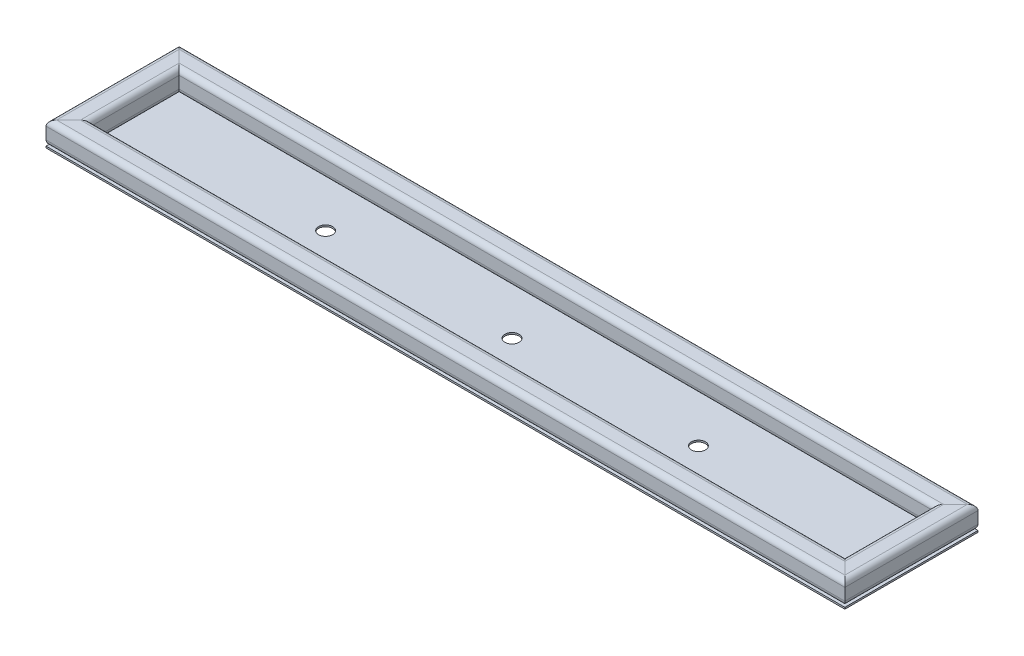
from build123d import *

# Parameters (mm, degrees)
TUBO_CUADRADO_2_X_2_X_0_25_1_DEPTH      = 186.921024484
TUBO_CUADRADO_2_X_2_X_0_25_1_DEPTH_BACK = 36.921024484
TUBO_CUADRADO_2_X_2_X_0_25_1_2_DEPTH    = 973.842048969
TUBO_CUADRADO_2_X_2_X_0_25_1_3_DEPTH    = 223.842048969
TUBO_CUADRADO_2_X_2_X_0_25_1_4_DEPTH    = 973.842048969
CROQUIS3_W                              = 900
CROQUIS3_H                              = 150
SALIENTE_EXTRUIR1_DEPTH                 = 1.9
CROQUIS4_R                              = 7.937500001
CORTAR_EXTRUIR1_DEPTH                   = 10


with BuildPart() as part:
    # Sketch1 → Tubo cuadrado 2 X 2 X 0.25(1) (new, two sides: drawn at the far end of the back side and taken through both)
    with BuildSketch(Plane(origin=(-437.3, 12.7, -75), x_dir=(1, 0, 0), z_dir=(0, 0, 1)).offset(-TUBO_CUADRADO_2_X_2_X_0_25_1_DEPTH_BACK)):
        with BuildLine():
            Line((-6.7, -12.7), (6.7, -12.7))
            ThreePointArc((6.7, -12.7), (10.942640687, -10.942640687), (12.7, -6.7))
            Line((12.7, -6.7), (12.7, 6.7))
            ThreePointArc((12.7, 6.7), (10.942640687, 10.942640687), (6.7, 12.7))
            Line((6.7, 12.7), (-6.7, 12.7))
            ThreePointArc((-6.7, 12.7), (-10.942640687, 10.942640687), (-12.7, 6.7))
            Line((-12.7, 6.7), (-12.7, -6.7))
            ThreePointArc((-12.7, -6.7), (-10.942640687, -10.942640687), (-6.7, -12.7))
        make_face()
        with BuildLine():
            Line((-6.7, -9.7), (6.7, -9.7))
            ThreePointArc((6.7, -9.7), (8.821320344, -8.821320344), (9.7, -6.7))
            Line((9.7, -6.7), (9.7, 6.7))
            ThreePointArc((9.7, 6.7), (8.821320344, 8.821320344), (6.7, 9.7))
            Line((6.7, 9.7), (-6.7, 9.7))
            ThreePointArc((-6.7, 9.7), (-8.821320344, 8.821320344), (-9.7, 6.7))
            Line((-9.7, 6.7), (-9.7, -6.7))
            ThreePointArc((-9.7, -6.7), (-8.821320344, -8.821320344), (-6.7, -9.7))
        make_face(mode=Mode.SUBTRACT)
    extrude(amount=TUBO_CUADRADO_2_X_2_X_0_25_1_DEPTH + TUBO_CUADRADO_2_X_2_X_0_25_1_DEPTH_BACK)

    # Tubo cuadrado 2 X 2 X 0.25(1) mitre 1
    split(bisect_by=Plane(origin=(-450, 0, -75), x_dir=(0, -1, 0), z_dir=(-0.707106781, 0, 0.707106781)), keep=Keep.TOP)

    # Tubo cuadrado 2 X 2 X 0.25(1) mitre 2
    split(bisect_by=Plane(origin=(-450, 0, 75), x_dir=(0, -1, 0), z_dir=(-0.707106781, 0, -0.707106781)), keep=Keep.TOP)


with BuildPart() as body_2:
    # Sketch1 on segment 2 (carried to segment 2) → Tubo cuadrado 2 X 2 X 0.25_1 2 (new body)
    with BuildSketch(Plane(origin=(-486.921024484, 12.7, 62.3), x_dir=(0, 0, -1), z_dir=(1, 0, 0))):
        with BuildLine():
            Line((-6.7, -12.7), (6.7, -12.7))
            ThreePointArc((6.7, -12.7), (10.942640687, -10.942640687), (12.7, -6.7))
            Line((12.7, -6.7), (12.7, 6.7))
            ThreePointArc((12.7, 6.7), (10.942640687, 10.942640687), (6.7, 12.7))
            Line((6.7, 12.7), (-6.7, 12.7))
            ThreePointArc((-6.7, 12.7), (-10.942640687, 10.942640687), (-12.7, 6.7))
            Line((-12.7, 6.7), (-12.7, -6.7))
            ThreePointArc((-12.7, -6.7), (-10.942640687, -10.942640687), (-6.7, -12.7))
        make_face()
        with BuildLine():
            Line((-6.7, -9.7), (6.7, -9.7))
            ThreePointArc((6.7, -9.7), (8.821320344, -8.821320344), (9.7, -6.7))
            Line((9.7, -6.7), (9.7, 6.7))
            ThreePointArc((9.7, 6.7), (8.821320344, 8.821320344), (6.7, 9.7))
            Line((6.7, 9.7), (-6.7, 9.7))
            ThreePointArc((-6.7, 9.7), (-8.821320344, 8.821320344), (-9.7, 6.7))
            Line((-9.7, 6.7), (-9.7, -6.7))
            ThreePointArc((-9.7, -6.7), (-8.821320344, -8.821320344), (-6.7, -9.7))
        make_face(mode=Mode.SUBTRACT)
    extrude(amount=TUBO_CUADRADO_2_X_2_X_0_25_1_2_DEPTH)

    # Tubo cuadrado 2 X 2 X 0.25_1 2 mitre 1
    split(bisect_by=Plane(origin=(-450, 0, 75), x_dir=(0, 1, 0), z_dir=(0.707106781, 0, 0.707106781)), keep=Keep.TOP)

    # Tubo cuadrado 2 X 2 X 0.25_1 2 mitre 2
    split(bisect_by=Plane(origin=(450, 0, 75), x_dir=(0, -1, 0), z_dir=(-0.707106781, 0, 0.707106781)), keep=Keep.TOP)


with BuildPart() as body_3:
    # Sketch1 on segment 3 (carried to segment 3) → Tubo cuadrado 2 X 2 X 0.25_1 3 (new body)
    with BuildSketch(Plane(origin=(437.3, 12.7, 111.921024484), x_dir=(-1, 0, 0), z_dir=(0, 0, -1))):
        with BuildLine():
            Line((-6.7, -12.7), (6.7, -12.7))
            ThreePointArc((6.7, -12.7), (10.942640687, -10.942640687), (12.7, -6.7))
            Line((12.7, -6.7), (12.7, 6.7))
            ThreePointArc((12.7, 6.7), (10.942640687, 10.942640687), (6.7, 12.7))
            Line((6.7, 12.7), (-6.7, 12.7))
            ThreePointArc((-6.7, 12.7), (-10.942640687, 10.942640687), (-12.7, 6.7))
            Line((-12.7, 6.7), (-12.7, -6.7))
            ThreePointArc((-12.7, -6.7), (-10.942640687, -10.942640687), (-6.7, -12.7))
        make_face()
        with BuildLine():
            Line((-6.7, -9.7), (6.7, -9.7))
            ThreePointArc((6.7, -9.7), (8.821320344, -8.821320344), (9.7, -6.7))
            Line((9.7, -6.7), (9.7, 6.7))
            ThreePointArc((9.7, 6.7), (8.821320344, 8.821320344), (6.7, 9.7))
            Line((6.7, 9.7), (-6.7, 9.7))
            ThreePointArc((-6.7, 9.7), (-8.821320344, 8.821320344), (-9.7, 6.7))
            Line((-9.7, 6.7), (-9.7, -6.7))
            ThreePointArc((-9.7, -6.7), (-8.821320344, -8.821320344), (-6.7, -9.7))
        make_face(mode=Mode.SUBTRACT)
    extrude(amount=TUBO_CUADRADO_2_X_2_X_0_25_1_3_DEPTH)

    # Tubo cuadrado 2 X 2 X 0.25_1 3 mitre 1
    split(bisect_by=Plane(origin=(450, 0, -75), x_dir=(0, 1, 0), z_dir=(0.707106781, 0, 0.707106781)), keep=Keep.TOP)

    # Tubo cuadrado 2 X 2 X 0.25_1 3 mitre 2
    split(bisect_by=Plane(origin=(450, 0, 75), x_dir=(0, 1, 0), z_dir=(0.707106781, 0, -0.707106781)), keep=Keep.TOP)


with BuildPart() as body_4:
    # Sketch1 on segment 4 (carried to segment 4) → Tubo cuadrado 2 X 2 X 0.25_1 4 (new body)
    with BuildSketch(Plane(origin=(486.921024484, 12.7, -62.3), x_dir=(0, 0, 1), z_dir=(-1, 0, 0))):
        with BuildLine():
            Line((-6.7, -12.7), (6.7, -12.7))
            ThreePointArc((6.7, -12.7), (10.942640687, -10.942640687), (12.7, -6.7))
            Line((12.7, -6.7), (12.7, 6.7))
            ThreePointArc((12.7, 6.7), (10.942640687, 10.942640687), (6.7, 12.7))
            Line((6.7, 12.7), (-6.7, 12.7))
            ThreePointArc((-6.7, 12.7), (-10.942640687, 10.942640687), (-12.7, 6.7))
            Line((-12.7, 6.7), (-12.7, -6.7))
            ThreePointArc((-12.7, -6.7), (-10.942640687, -10.942640687), (-6.7, -12.7))
        make_face()
        with BuildLine():
            Line((-6.7, -9.7), (6.7, -9.7))
            ThreePointArc((6.7, -9.7), (8.821320344, -8.821320344), (9.7, -6.7))
            Line((9.7, -6.7), (9.7, 6.7))
            ThreePointArc((9.7, 6.7), (8.821320344, 8.821320344), (6.7, 9.7))
            Line((6.7, 9.7), (-6.7, 9.7))
            ThreePointArc((-6.7, 9.7), (-8.821320344, 8.821320344), (-9.7, 6.7))
            Line((-9.7, 6.7), (-9.7, -6.7))
            ThreePointArc((-9.7, -6.7), (-8.821320344, -8.821320344), (-6.7, -9.7))
        make_face(mode=Mode.SUBTRACT)
    extrude(amount=TUBO_CUADRADO_2_X_2_X_0_25_1_4_DEPTH)

    # Tubo cuadrado 2 X 2 X 0.25_1 4 mitre 1
    split(bisect_by=Plane(origin=(-450, 0, -75), x_dir=(0, 1, 0), z_dir=(0.707106781, 0, -0.707106781)), keep=Keep.TOP)

    # Tubo cuadrado 2 X 2 X 0.25_1 4 mitre 2
    split(bisect_by=Plane(origin=(450, 0, -75), x_dir=(0, -1, 0), z_dir=(-0.707106781, 0, -0.707106781)), keep=Keep.TOP)


with BuildPart() as body_5:
    # Croquis3 → Saliente-Extruir1 (new body)
    with BuildSketch(Plane.XZ):
        Rectangle(CROQUIS3_W, CROQUIS3_H)
    extrude(amount=SALIENTE_EXTRUIR1_DEPTH)

    # Croquis4 → Cortar-Extruir1 (cut)
    with BuildSketch(Plane(origin=(0, 0, 0), x_dir=(1, 0, 0), z_dir=(0, 1, 0))):
        with Locations(Location((-210, 0, 0), (0, 0, 180))):
            Circle(CROQUIS4_R)
        with Locations(Location((0, 0, 0), (0, 0, 180))):
            Circle(CROQUIS4_R)
        with Locations(Location((210, 0.002204666, 0), (0, 0, 180))):
            Circle(CROQUIS4_R)
    extrude(amount=-CORTAR_EXTRUIR1_DEPTH, mode=Mode.SUBTRACT)


solid = Compound([part.part, body_2.part, body_3.part, body_4.part, body_5.part])
